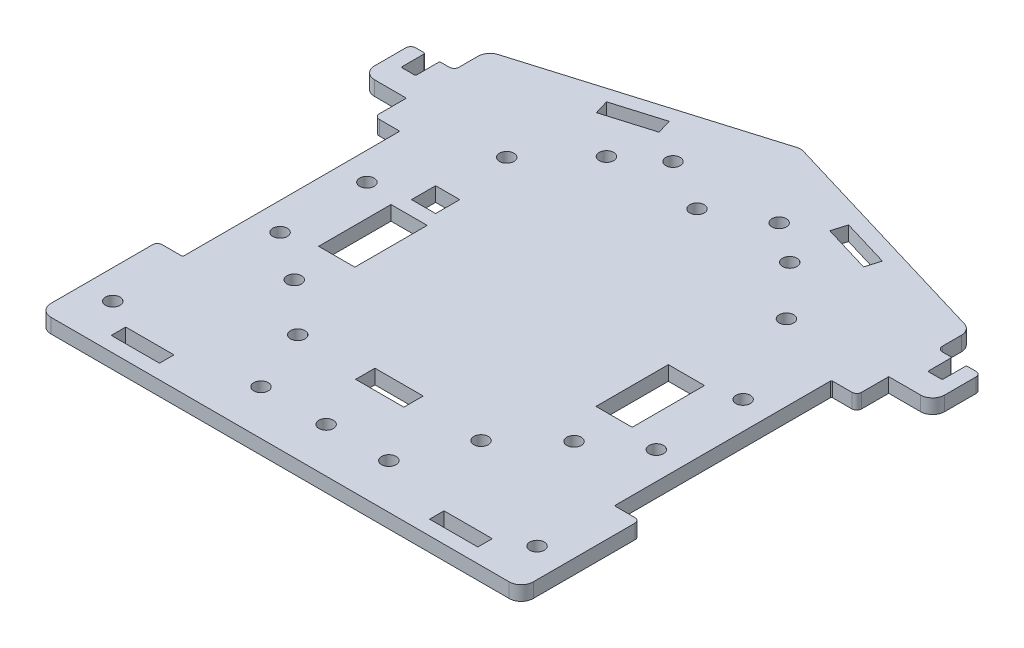
from build123d import *

# Parameters (mm, degrees)
CROQUIS3_W              = 7.5
CROQUIS3_H              = 15
SALIENTE_EXTRUIR1_DEPTH = 3
CROQUIS4_R              = 1.5
CROQUIS4_W              = 14
CROQUIS4_H              = 45
CROQUIS4_W_2            = 10
CROQUIS4_H_2            = 3
CORTAR_EXTRUIR1_DEPTH   = 3
SALIENTE_EXTRUIR2_DEPTH = 3
REDONDEO2_R             = 0.25
REDONDEO3_R             = 1
CROQUIS6_R              = 1.5
CROQUIS6_W              = 5
CROQUIS6_H              = 5
CROQUIS6_W_2            = 10
CROQUIS6_H_2            = 4
CORTAR_EXTRUIR2_DEPTH   = 5
CROQUIS7_R              = 1.5
CORTAR_EXTRUIR4_DEPTH   = 5


with BuildPart() as part:
    # Croquis3 → Saliente-Extruir1 (new body)
    with BuildSketch(Plane(origin=(0, 0, 0), x_dir=(1, 0, 0), z_dir=(0, 1, 0))):
        with BuildLine():
            Line((-50, -45), (50, -45))
            Line((50, -45), (50, 28.189923373))
            Line((50, 28.189923373), (56.6, 28.189923373))
            ThreePointArc((56.6, 28.189923373), (58.367766953, 28.92215642), (59.1, 30.689923373))
            Line((59.1, 30.689923373), (59.1, 38.189923373))
            Line((59.1, 38.189923373), (56.1, 38.189923373))
            Line((56.1, 38.189923373), (56.1, 33.189923373))
            Line((56.1, 33.189923373), (53.1, 33.189923373))
            Line((53.1, 33.189923373), (53.1, 38.189923373))
            Line((53.1, 38.189923373), (50.1, 38.189923373))
            Line((50.1, 38.189923373), (50.1, 43.139923373))
            ThreePointArc((50.1, 43.139923373), (49.605586306, 44.632445926), (48.317901143, 45.534629607))
            Line((48.317901143, 45.534629607), (0.615531773, 59.835166775))
            ThreePointArc((0.615531773, 59.835166775), (0, 59.908733938), (-0.615531773, 59.835166775))
            Line((-0.615531773, 59.835166775), (-48.317901143, 45.534629607))
            ThreePointArc((-48.317901143, 45.534629607), (-49.605586306, 44.632445926), (-50.1, 43.139923373))
            Line((-50.1, 43.139923373), (-50.1, 38.189923373))
            Line((-50.1, 38.189923373), (-53.1, 38.189923373))
            Line((-53.1, 38.189923373), (-53.1, 33.189923373))
            Line((-53.1, 33.189923373), (-56.1, 33.189923373))
            Line((-56.1, 33.189923373), (-56.1, 38.189923373))
            Line((-56.1, 38.189923373), (-59.1, 38.189923373))
            Line((-59.1, 38.189923373), (-59.1, 30.689923373))
            ThreePointArc((-59.1, 30.689923373), (-58.367766953, 28.92215642), (-56.6, 28.189923373))
            Line((-56.6, 28.189923373), (-50, 28.189923373))
            Line((-50, 28.189923373), (-50, -45))
        make_face()
        with Locations((28.75, 0)):
            Rectangle(CROQUIS3_W, CROQUIS3_H, mode=Mode.SUBTRACT)
        with Locations((-28.75, 0)):
            Rectangle(CROQUIS3_W, CROQUIS3_H, mode=Mode.SUBTRACT)
        Polygon((-23.595339952, 49.778243466), (-18.595339952, 51.277177099), (-17.695979772, 48.277177099), (-27.695979772, 45.279309832), (-28.595339952, 48.279309832), align=None, mode=Mode.SUBTRACT)
        Polygon((28.595339952, 48.279309832), (27.695979772, 45.279309832), (17.695979772, 48.277177099), (18.595339952, 51.277177099), (23.595339952, 49.778243466), align=None, mode=Mode.SUBTRACT)
    extrude(amount=SALIENTE_EXTRUIR1_DEPTH)

    # Croquis4 → Cortar-Extruir1 (cut, symmetric)
    with BuildSketch(Plane(origin=(0, 3, 0), x_dir=(1, 0, 0), z_dir=(0, 1, 0))):
        with Locations(Location((0.25, -38.703289419, 0), (0, 0, 270))):
            Circle(CROQUIS4_R)
        with Locations(Location((-39, 9, 0), (0, 0, 270))):
            Circle(CROQUIS4_R)
        with Locations(Location((39, 9, 0), (0, 0, 270))):
            Circle(CROQUIS4_R)
        with Locations(Location((39, -9, 0), (0, 0, 270))):
            Circle(CROQUIS4_R)
        with Locations(Location((-39, -9, 0), (0, 0, 270))):
            Circle(CROQUIS4_R)
        with Locations(Location((-43.980956203, -38.703289419, 0), (0, 0, 270))):
            Circle(CROQUIS4_R)
        with Locations(Location((-13.25, -38.703289419, 0), (0, 0, 270))):
            Circle(CROQUIS4_R)
        with Locations(Location((13.25, -38.703289419, 0), (0, 0, 270))):
            Circle(CROQUIS4_R)
        with Locations(Location((43.980956203, -38.703289419, 0), (0, 0, 270))):
            Circle(CROQUIS4_R)
        with Locations((51.75, -0.930038314)):
            Rectangle(CROQUIS4_W, CROQUIS4_H)
        with Locations((-51.75, -0.930038314)):
            Rectangle(CROQUIS4_W, CROQUIS4_H)
        with Locations((-33, -43.5)):
            Rectangle(CROQUIS4_W_2, CROQUIS4_H_2)
        with Locations((33, -43.5)):
            Rectangle(CROQUIS4_W_2, CROQUIS4_H_2)
    extrude(amount=CORTAR_EXTRUIR1_DEPTH, both=True, mode=Mode.SUBTRACT)

    # Croquis5 → Saliente-Extruir2 (add)
    with BuildSketch(Plane(origin=(0, 0, 0), x_dir=(1, 0, 0), z_dir=(0, 1, 0))):
        with BuildLine():
            Line((-50, -45), (50, -45))
            Line((50, -45), (50, -45.5))
            ThreePointArc((50, -45.5), (49.267766953, -47.267766953), (47.5, -48))
            Line((47.5, -48), (-47.5, -48))
            ThreePointArc((-47.5, -48), (-49.267766953, -47.267766953), (-50, -45.5))
            Line((-50, -45.5), (-50, -45))
        make_face()
    extrude(amount=SALIENTE_EXTRUIR2_DEPTH)

    # Redondeo2
    redondeo2_edges = [part.edges().sort_by_distance(p)[0] for p in [
        (-44.75, 1.5, -21.569961686),
        (-44.75, 1.5, 23.430038314),
        (44.75, 1.5, 23.430038314),
        (44.75, 1.5, -21.569961686),
        (-56.1, 1.5, -38.189923373),
        (-56.1, 1.5, -33.189923373),
        (-53.1, 1.5, -33.189923373),
        (-53.1, 1.5, -38.189923373),
        (53.1, 1.5, -38.189923373),
        (53.1, 1.5, -33.189923373),
        (56.1, 1.5, -33.189923373),
        (56.1, 1.5, -38.189923373),
    ]]
    fillet(redondeo2_edges, radius=REDONDEO2_R)

    # Redondeo3
    redondeo3_edges = [part.edges().sort_by_distance(p)[0] for p in [
        (-50, 1.5, -21.569961686),
        (-50, 1.5, 23.430038314),
        (50, 1.5, -21.569961686),
        (50, 1.5, 23.430038314),
        (-59.1, 1.5, -38.189923373),
        (-50.1, 1.5, -38.189923373),
        (50.1, 1.5, -38.189923373),
        (59.1, 1.5, -38.189923373),
    ]]
    fillet(redondeo3_edges, radius=REDONDEO3_R)

    # Croquis6 → Cortar-Extruir2 (cut, symmetric)
    with BuildSketch(Plane(origin=(0, 3, 0), x_dir=(1, 0, 0), z_dir=(0, 1, 0))):
        with Locations(Location((-18.777873171, -25.555868596, 0), (0, 0, 270))):
            Circle(CROQUIS6_R)
        with Locations(Location((-18.777873171, 38.444131404, 0), (0, 0, 270))):
            Circle(CROQUIS6_R)
        with Locations(Location((19.222126829, -25.555868596, 0), (0, 0, 270))):
            Circle(CROQUIS6_R)
        with Locations(Location((19.222126829, 38.444131404, 0), (0, 0, 270))):
            Circle(CROQUIS6_R)
        with Locations((-28.75, 13)):
            Rectangle(CROQUIS6_W, CROQUIS6_H)
        with Locations((0.222126829, -25.555868596)):
            Rectangle(CROQUIS6_W_2, CROQUIS6_H_2)
    extrude(amount=CORTAR_EXTRUIR2_DEPTH, both=True, mode=Mode.SUBTRACT)

    # Croquis7 → Cortar-Extruir4 (cut, symmetric)
    with BuildSketch(Plane(origin=(0, 3, 0), x_dir=(1, 0, 0), z_dir=(0, 1, 0))):
        with Locations(Location((29.022405425, 27.963870269, 0), (0, 0, 270))):
            Circle(CROQUIS7_R)
        with Locations(Location((-29, -16.050530834, 0), (0, 0, 270))):
            Circle(CROQUIS7_R)
        with Locations(Location((29, -16.050530834, 0), (0, 0, 270))):
            Circle(CROQUIS7_R)
        with Locations(Location((-28.977594575, 27.963870269, 0), (0, 0, 270))):
            Circle(CROQUIS7_R)
        with Locations(Location((-10.977594575, 44.444131404, 0), (0, 0, 270))):
            Circle(CROQUIS7_R)
        with Locations(Location((11.022405425, 44.444131404, 0), (0, 0, 270))):
            Circle(CROQUIS7_R)
        with Locations(Location((0, 38.444131404, 0), (0, 0, 270))):
            Circle(CROQUIS7_R)
    extrude(amount=CORTAR_EXTRUIR4_DEPTH, both=True, mode=Mode.SUBTRACT)


solid = part.part
